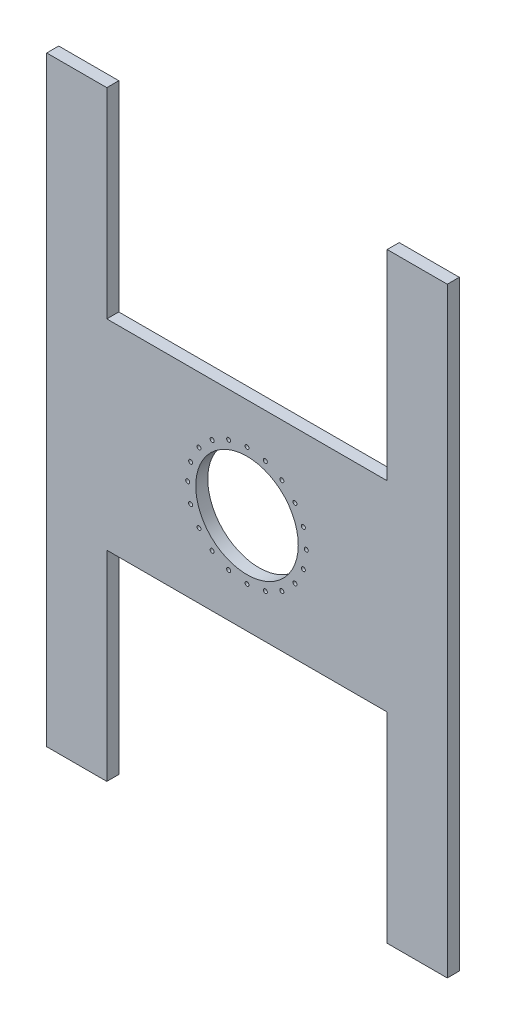
from build123d import *

# Parameters (mm, degrees)
BOSS_EXTRU_1_DEPTH           = 60
ESQUISSE2_R                  = 256
ENL_V_MAT_EXTRU_1_DEPTH      = 2237.872817127
ESQUISSE5_R                  = 10
ENL_V_MAT_EXTRU_3_DEPTH      = 2237.872817127
R_P_TITION_CIRCULAIRE1_COUNT = 20


with BuildPart() as part:
    # Esquisse1 → Boss.-Extru.1 (new body)
    with BuildSketch(Plane.XY):
        Polygon((-1000, 2000), (-700, 2000), (-700, 1000), (700, 1000), (700, 2000), (1000, 2000), (1000, -1000), (700, -1000), (700, 0), (-700, 0), (-700, -1000), (-1000, -1000), align=None)
    extrude(amount=BOSS_EXTRU_1_DEPTH)

    # Esquisse2 → Enlèv. mat.-Extru.1 (cut, through all)
    with BuildSketch(Plane.XY.offset(60)):
        with Locations((0, 500)):
            Circle(ESQUISSE2_R)
    extrude(amount=-ENL_V_MAT_EXTRU_1_DEPTH, mode=Mode.SUBTRACT)

    # Esquisse5 → Enlèv. mat.-Extru.3 (cut, through all)
    with BuildSketch(Plane.XY):
        with Locations((0, 796)):
            Circle(ESQUISSE5_R)
    enl_v_mat_extru_3 = extrude(amount=ENL_V_MAT_EXTRU_3_DEPTH, mode=Mode.SUBTRACT)

    # Répétition circulaire1: Enlèv. mat.-Extru.3 ×20 about axis
    r_p_tition_circulaire1_axis = Axis((0, 500, 0), (0, 0, 1))
    for i in range(1, R_P_TITION_CIRCULAIRE1_COUNT):
        add(enl_v_mat_extru_3.rotate(r_p_tition_circulaire1_axis, i * 360 / R_P_TITION_CIRCULAIRE1_COUNT), mode=Mode.SUBTRACT)


solid = part.part
